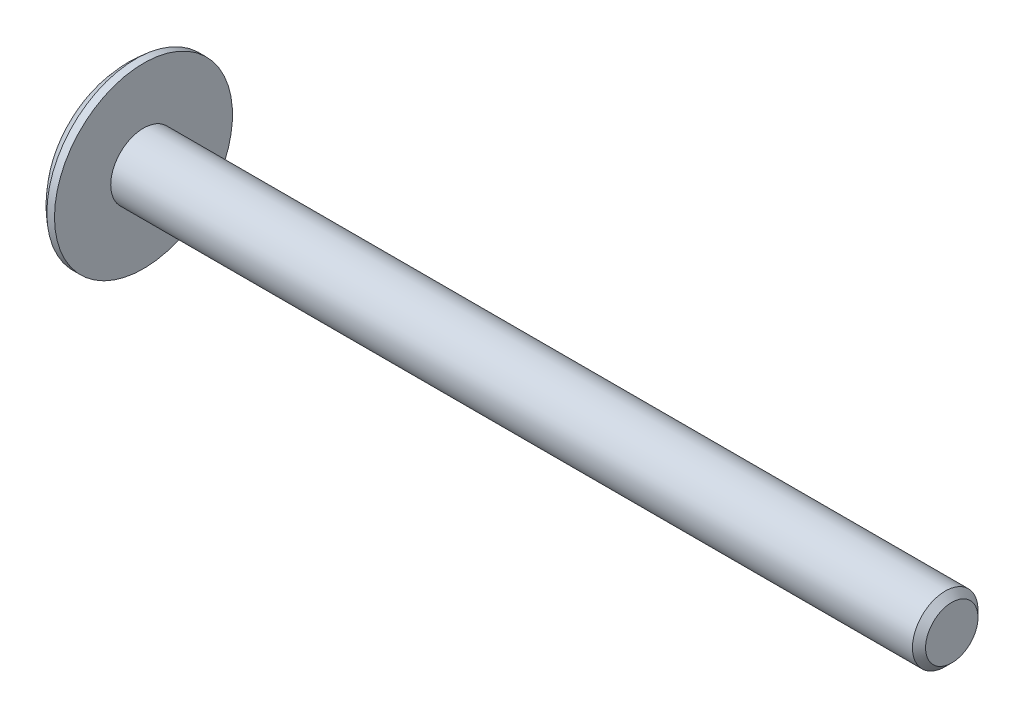
from build123d import *

# Parameters (mm, degrees)
CUT_EXTRUDE1_DEPTH = 1


with BuildPart() as part:
    # Sketch1 → Revolve1 (revolve)
    with BuildSketch(Plane.XY, mode=Mode.PRIVATE) as revolve1_sk:
        with BuildLine():
            Line((0, 0), (0, 1.425))
            ThreePointArc((0, 1.425), (0.342509352, 2.900635456), (1.3, 4.07452826))
            Line((1.3, 4.07452826), (1.65, 4.07452826))
            Line((1.65, 4.07452826), (1.65, 1.5))
            Line((1.65, 1.5), (38.35, 1.5))
            Line((38.35, 1.5), (38.65, 1.2))
            Line((38.65, 1.2), (38.65, 0))
            Line((38.65, 0), (0, 0))
        make_face()
    revolve(revolve1_sk.sketch.rotate(Axis((0, 0, 0), (1, 0, 0)), 90), axis=Axis((0, 0, 0), (1, 0, 0)))

    # Sketch2 → Cut-Extrude1 (cut)
    with BuildSketch(Plane.ZY):
        Polygon((0, 1.154700538), (-1, 0.577350269), (-1, -0.577350269), (0, -1.154700538), (1, -0.577350269), (1, 0.577350269), align=None)
    extrude(amount=-CUT_EXTRUDE1_DEPTH, mode=Mode.SUBTRACT)


solid = part.part
